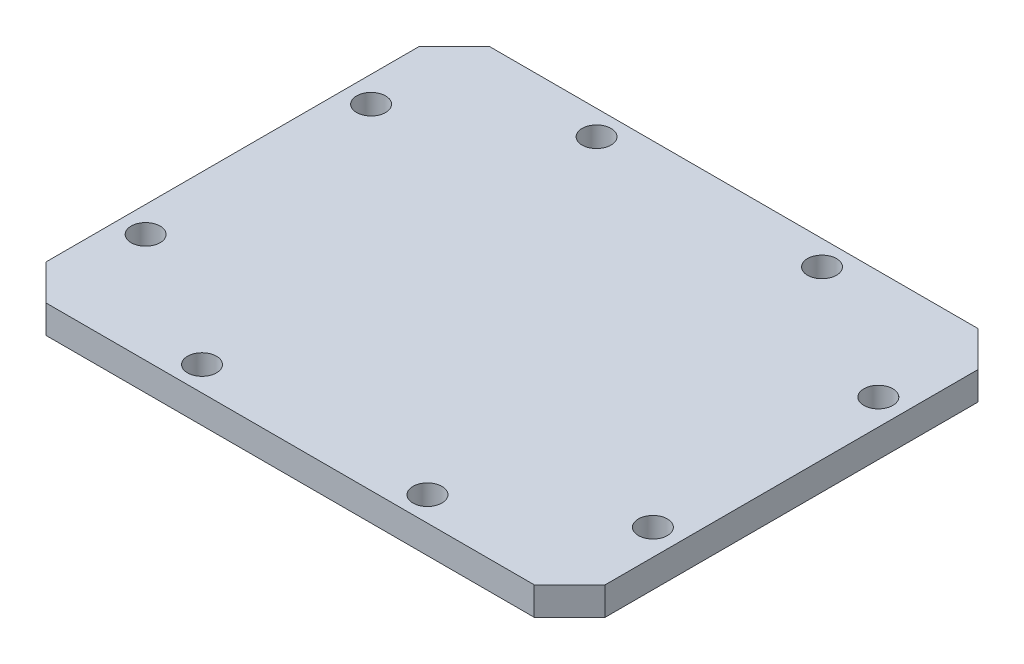
from build123d import *

# Parameters (mm, degrees)
SKETCH1_W           = 63
SKETCH1_H           = 50
SKETCH1_R           = 1.63195
BOSS_EXTRUDE1_DEPTH = 3.175
CHAMFER1_SIZE       = 4


with BuildPart() as part:
    # Sketch1 → Boss-Extrude1 (new body)
    with BuildSketch(Plane(origin=(0, 0, 0), x_dir=(1, 0, 0), z_dir=(0, 1, 0))):
        with Locations((31.5, -25)):
            Rectangle(SKETCH1_W, SKETCH1_H)
        with Locations(Location((18.8, -2.775, 0), (0, 0, 270))):
            Circle(SKETCH1_R, mode=Mode.SUBTRACT)
        with Locations(Location((44.2, -2.775, 0), (0, 0, 270))):
            Circle(SKETCH1_R, mode=Mode.SUBTRACT)
        with Locations(Location((60.075, -12.3, 0), (0, 0, 270))):
            Circle(SKETCH1_R, mode=Mode.SUBTRACT)
        with Locations(Location((60.075, -37.7, 0), (0, 0, 270))):
            Circle(SKETCH1_R, mode=Mode.SUBTRACT)
        with Locations(Location((44.2, -47.225, 0), (0, 0, 270))):
            Circle(SKETCH1_R, mode=Mode.SUBTRACT)
        with Locations(Location((18.8, -47.225, 0), (0, 0, 270))):
            Circle(SKETCH1_R, mode=Mode.SUBTRACT)
        with Locations(Location((2.925, -37.7, 0), (0, 0, 270))):
            Circle(SKETCH1_R, mode=Mode.SUBTRACT)
        with Locations(Location((2.925, -12.3, 0), (0, 0, 270))):
            Circle(SKETCH1_R, mode=Mode.SUBTRACT)
    extrude(amount=BOSS_EXTRUDE1_DEPTH)

    # Chamfer1
    chamfer1_edges = [part.edges().sort_by_distance(p)[0] for p in [
        (0, 1.5875, 0),
        (63, 1.5875, 0),
        (63, 1.5875, 50),
        (0, 1.5875, 50),
    ]]
    chamfer(chamfer1_edges, length=CHAMFER1_SIZE)


solid = part.part
